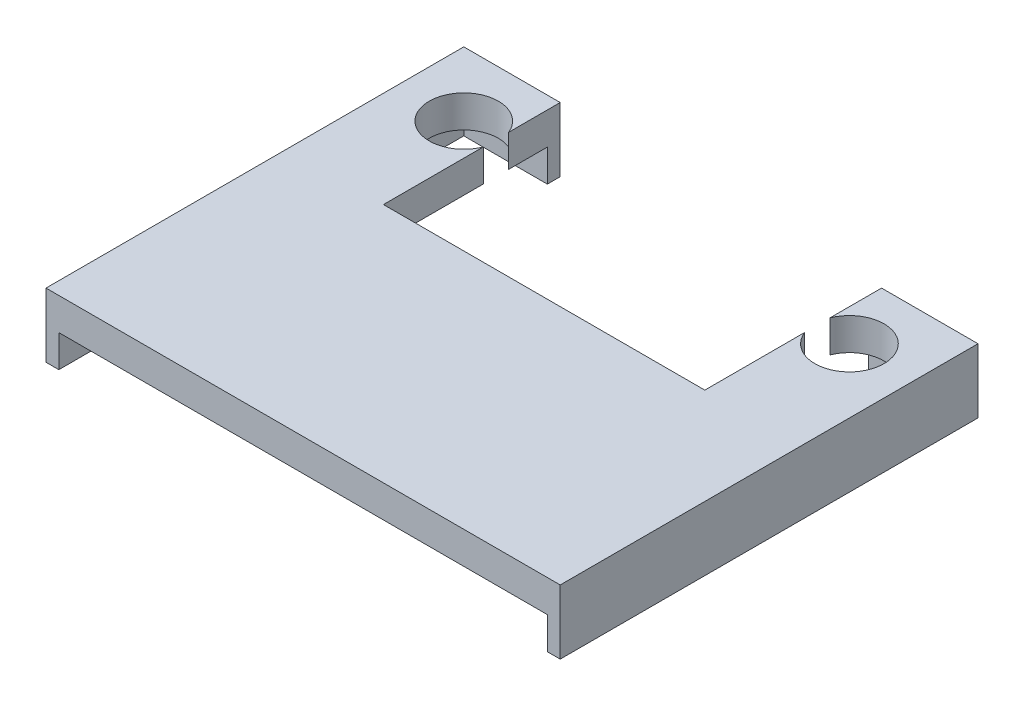
from build123d import *

# Parameters (mm, degrees)
SKETCH1_W           = 80
SKETCH1_H           = 80
BOSS_EXTRUDE2_DEPTH = 10
CUT_EXTRUDE2_DEPTH  = 14
CUT_EXTRUDE3_DEPTH  = 14
CUT_EXTRUDE4_DEPTH  = 5
SCALE2_SCALE        = 0.1


with BuildPart() as part:
    # Sketch1 → Boss-Extrude2 (new body)
    with BuildSketch(Plane(origin=(0, 0, 0), x_dir=(1, 0, 0), z_dir=(0, 1, 0))):
        Rectangle(SKETCH1_W, SKETCH1_H)
    extrude(amount=BOSS_EXTRUDE2_DEPTH)

    # Sketch1<8> → Cut-Extrude2 (cut)
    with BuildSketch(Plane(origin=(0, 0, 0), x_dir=(1, 0, 0), z_dir=(0, 1, 0))):
        with BuildLine():
            Line((25, 40), (-25, 40))
            Line((-25, 40), (-25, 31.971455811))
            ThreePointArc((-25, 31.971455811), (-35.374629105, 30), (-25, 28.028544189))
            Line((-25, 28.028544189), (-25, 12.5))
            Line((-25, 12.5), (25, 12.5))
            Line((25, 12.5), (25, 28.028544189))
            ThreePointArc((25, 28.028544189), (35.374629105, 30), (25, 31.971455811))
            Line((25, 31.971455811), (25, 40))
        make_face()
    extrude(amount=CUT_EXTRUDE2_DEPTH, mode=Mode.SUBTRACT)

    # Sketch4 → Cut-Extrude3 (cut)
    with BuildSketch(Plane.XZ):
        Polygon((40, 40), (-40, 40), (-40, 25), (-38, 25), (38, 25), (40, 25), align=None)
    extrude(amount=-CUT_EXTRUDE3_DEPTH, mode=Mode.SUBTRACT)

    # Sketch4<4> → Cut-Extrude4 (cut)
    with BuildSketch(Plane.XZ):
        with BuildLine():
            Line((38, 25), (-38, 25))
            Line((-38, 25), (-38, -38))
            Line((-38, -38), (-27, -38))
            Line((-27, -38), (-25, -38))
            Line((-25, -38), (-25, -31.971455811))
            ThreePointArc((-25, -31.971455811), (-35.374629105, -30), (-25, -28.028544189))
            Line((-25, -28.028544189), (-25, -12.5))
            Line((-25, -12.5), (25, -12.5))
            Line((25, -12.5), (25, -28.028544189))
            ThreePointArc((25, -28.028544189), (35.374629105, -30), (25, -31.971455811))
            Line((25, -31.971455811), (25, -38))
            Line((25, -38), (27, -38))
            Line((27, -38), (38, -38))
            Line((38, -38), (38, 25))
        make_face()
    extrude(amount=-CUT_EXTRUDE4_DEPTH, mode=Mode.SUBTRACT)


with BuildPart() as part_1:
    # Scale2: scaled about (0, 7.105810112, -0.378714582)
    add(part.part.scale(SCALE2_SCALE).moved(Location((0, 6.395229101, -0.340843124))))


solid = part_1.part
